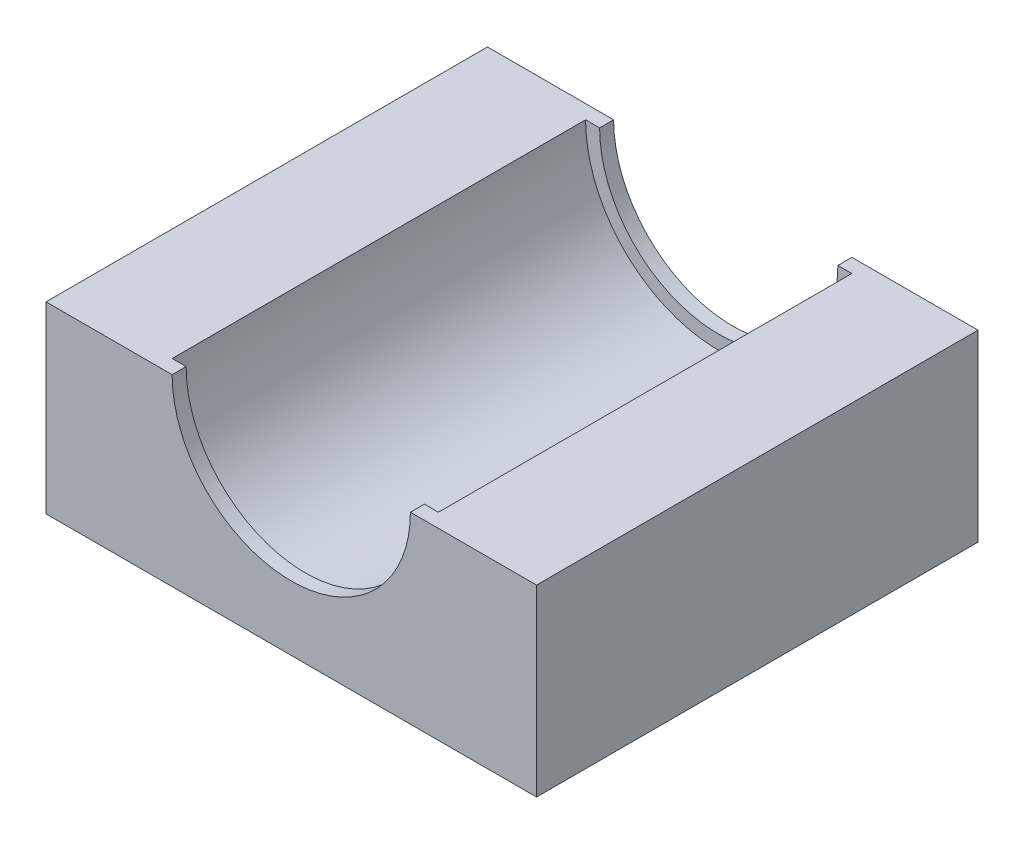
from build123d import *

# Parameters (mm, degrees)
BOSS_EXTRUDE1_DEPTH = 63
BOSS_EXTRUDE2_START = -2
BOSS_EXTRUDE2_DEPTH = 2


with BuildPart() as part:
    # Sketch1 → Boss-Extrude1 (new body)
    with BuildSketch(Plane.XY):
        with BuildLine():
            Line((0, 0), (70, 0))
            Line((70, 0), (70, 26.2))
            Line((70, 26.2), (54, 26.2))
            ThreePointArc((54, 26.2), (35, 7.2), (16, 26.2))
            Line((16, 26.2), (0, 26.2))
            Line((0, 26.2), (0, 0))
        make_face()
    extrude(amount=BOSS_EXTRUDE1_DEPTH)

    # Sketch2 → Boss-Extrude2 (add)
    with BuildSketch(Plane.XY.offset(63).offset(BOSS_EXTRUDE2_START)):
        with BuildLine():
            Line((18, 26.2), (16, 26.2))
            ThreePointArc((16, 26.2), (35, 7.2), (54, 26.2))
            Line((54, 26.2), (52, 26.2))
            ThreePointArc((52, 26.2), (35, 9.2), (18, 26.2))
        make_face()
    boss_extrude2 = extrude(amount=BOSS_EXTRUDE2_DEPTH)

    # Mirror1: Boss-Extrude2 across plane
    add(boss_extrude2.mirror(Plane(origin=(0, 0, 31.5), x_dir=(1, 0, 0), z_dir=(0, 0, -1))))


solid = part.part
